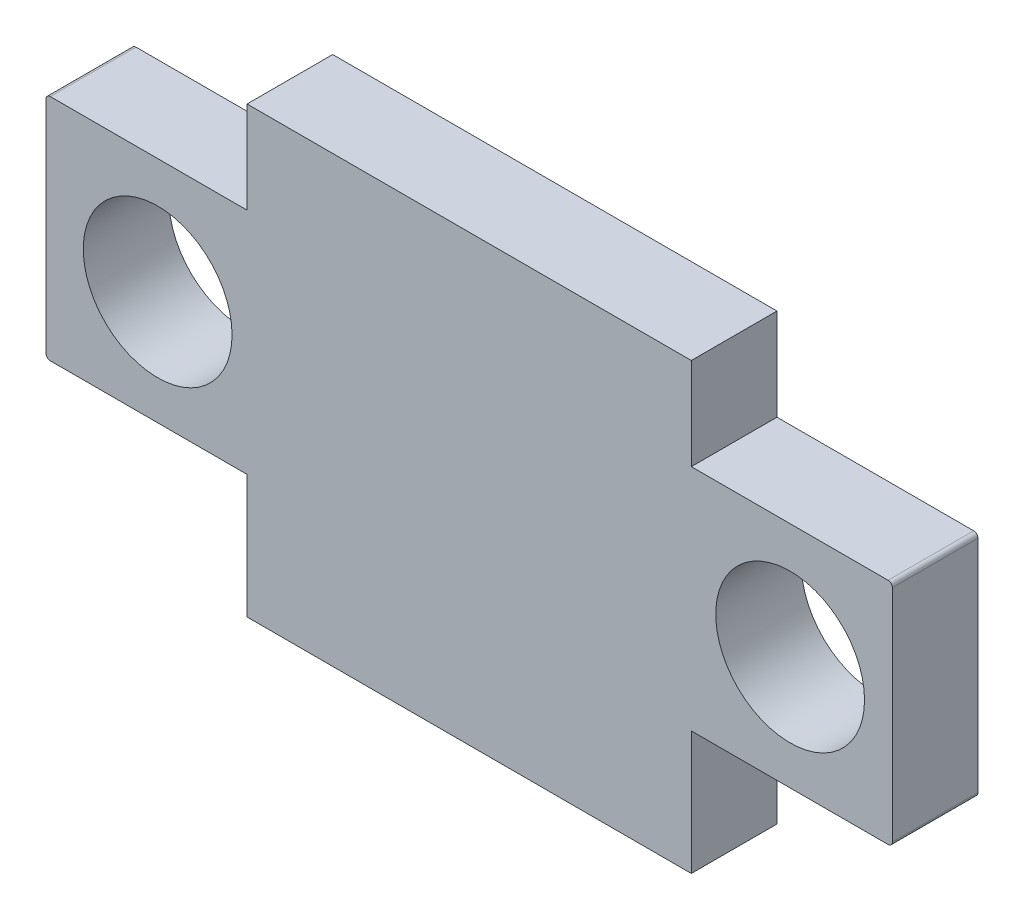
from build123d import *

# Parameters (mm, degrees)
SKETCH1_R           = 3.475
BOSS_EXTRUDE1_DEPTH = 4


with BuildPart() as part:
    # Sketch1 → Boss-Extrude1 (new body)
    # profile 1 of 3: a face of its own
    with BuildSketch(Plane.XY):
        with BuildLine():
            Line((-10.375, 6.080549062), (-19.564197283, 6.080549062))
            ThreePointArc((-19.564197283, 6.080549062), (-19.70561864, 6.021970418), (-19.764197283, 5.880549062))
            Line((-19.764197283, 5.880549062), (-19.764197283, -4.408416131))
            ThreePointArc((-19.764197283, -4.408416131), (-19.70561864, -4.549837487), (-19.564197283, -4.608416131))
            Line((-19.564197283, -4.608416131), (-10.375, -4.608416131))
            Line((-10.375, -4.608416131), (-10.375, 6.080549062))
        make_face()
        with Locations((-14.549223744, 0.688062131)):
            Circle(SKETCH1_R, mode=Mode.SUBTRACT)
    # profile 2 of 3: a face of its own
    with BuildSketch(Plane.XY):
        Polygon((-10.375, 10.375), (-10.375, 6.080549062), (-10.375, -4.608416131), (-10.375, -10.375), (10.375, -10.375), (10.375, -4.608416131), (10.375, 6.080549062), (10.375, 10.375), align=None)
    # profile 3 of 3: a face of its own
    with BuildSketch(Plane.XY):
        with BuildLine():
            Line((19.764197283, 5.880549062), (19.764197283, -4.408416131))
            ThreePointArc((19.764197283, -4.408416131), (19.70561864, -4.549837487), (19.564197283, -4.608416131))
            Line((19.564197283, -4.608416131), (10.375, -4.608416131))
            Line((10.375, -4.608416131), (10.375, 6.080549062))
            Line((10.375, 6.080549062), (19.564197283, 6.080549062))
            ThreePointArc((19.564197283, 6.080549062), (19.70561864, 6.021970418), (19.764197283, 5.880549062))
        make_face()
        with Locations((14.989443539, 0.688062131)):
            Circle(SKETCH1_R, mode=Mode.SUBTRACT)
    extrude(amount=BOSS_EXTRUDE1_DEPTH)


solid = part.part
